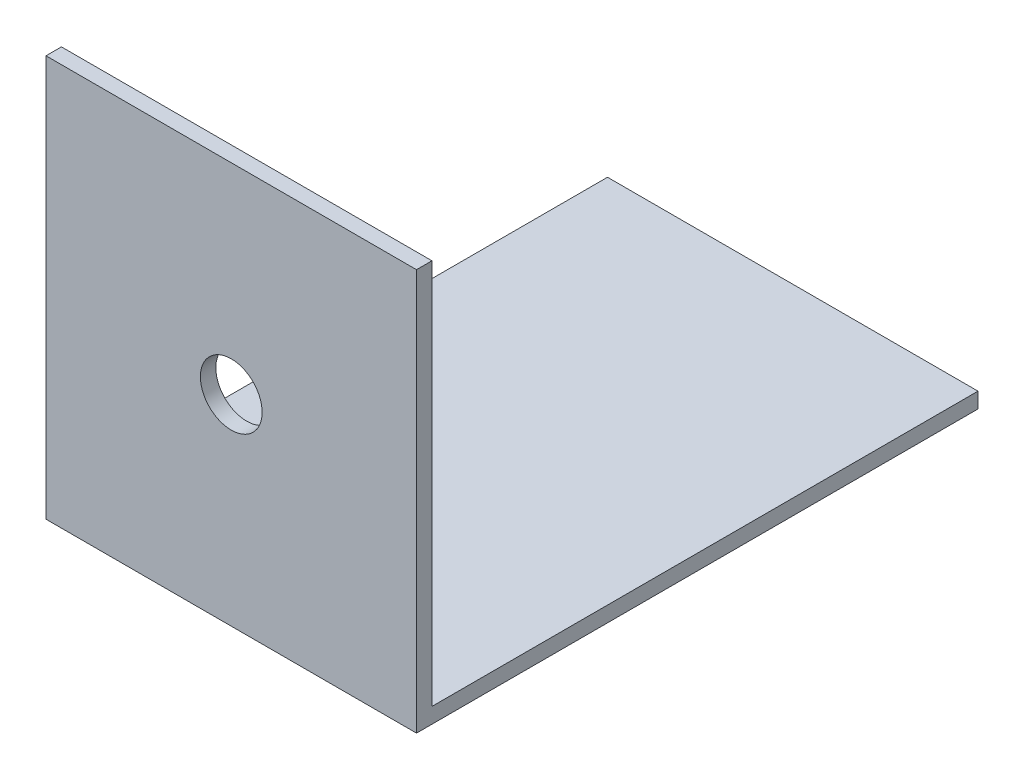
from build123d import *

# Parameters (mm, degrees)
EXTRUDE_1_DEPTH          = 120
CUT_EXTRUDE_1_DEPTH      = 34
CUT_EXTRUDE_1_DEPTH_BACK = 21
SKETCH_3_R               = 10


with BuildPart() as part:
    # 草图2 → 凸台-拉伸1 (new body)
    with BuildSketch(Plane(origin=(0, 0, 0), x_dir=(0, 0, -1), z_dir=(1, 0, 0))):
        Polygon((0, 0), (181.86, 0), (181.86, 5), (5, 5), (5, 130), (0, 130), align=None)
    extrude(amount=EXTRUDE_1_DEPTH)

    # 草图3 → 切除-拉伸1 (cut, two sides: drawn at the far end of the back side and taken through both)
    with BuildSketch(Plane.XY.offset(-CUT_EXTRUDE_1_DEPTH_BACK)):
        with Locations(Location((60, 65, 0), (0, 0, 270))):
            Circle(SKETCH_3_R)
    extrude(amount=CUT_EXTRUDE_1_DEPTH + CUT_EXTRUDE_1_DEPTH_BACK, mode=Mode.SUBTRACT)


solid = part.part
